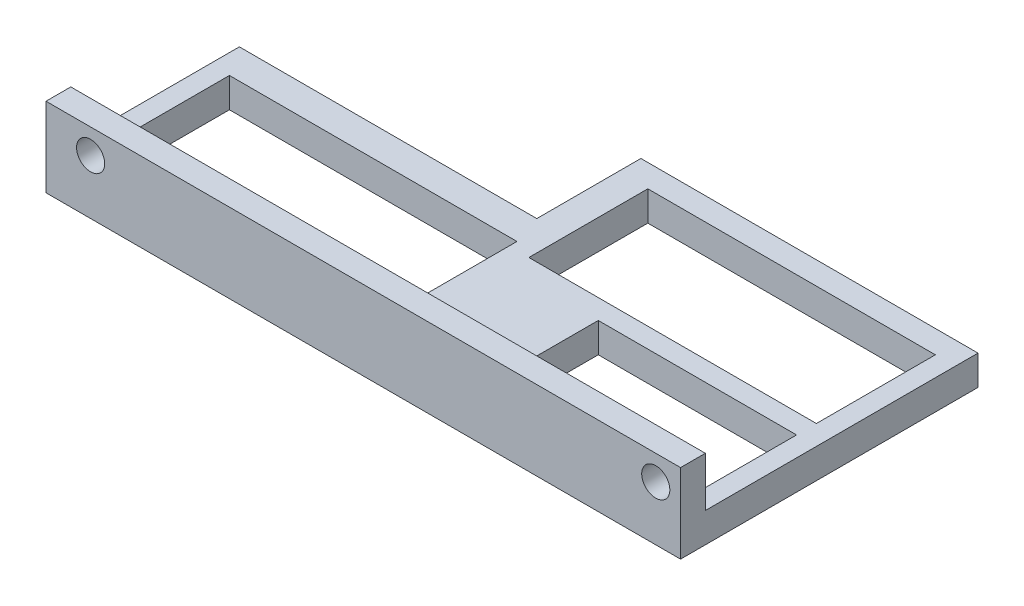
from build123d import *

# Parameters (mm, degrees)
SKETCH1_W           = 64
SKETCH1_H           = 30
BOSS_EXTRUDE1_DEPTH = 3
CUT_EXTRUDE1_REACH  = 72.746
SKETCH2_W           = 29
SKETCH2_H           = 12.5
SKETCH2_H_2         = 12
SKETCH2_W_2         = 20
SKETCH2_H_3         = 9.7
SKETCH2_W_3         = 30
SKETCH2_H_4         = 10.5
SKETCH3_W           = 64
SKETCH3_H           = 2.5
BOSS_EXTRUDE3_DEPTH = 5
CUT_EXTRUDE2_REACH  = 73.134
SKETCH4_R           = 1.419176597


with BuildPart() as part:
    # Sketch1 → Boss-Extrude1 (new body)
    with BuildSketch(Plane(origin=(0, 0, 0), x_dir=(1, 0, 0), z_dir=(0, 1, 0))):
        with Locations((32, 15)):
            Rectangle(SKETCH1_W, SKETCH1_H)
    extrude(amount=BOSS_EXTRUDE1_DEPTH)

    # Sketch2 → Cut-Extrude1 (cut, up to next)
    with BuildSketch(Plane(origin=(0, 3, 0), x_dir=(1, 0, 0), z_dir=(0, 1, 0)), mode=Mode.PRIVATE) as cut_extrude1_sk1:
        with Locations((16.5, 10.25)):
            Rectangle(SKETCH2_W, SKETCH2_H)
    cut_extrude1_tool1 = extrude(cut_extrude1_sk1.sketch, amount=-CUT_EXTRUDE1_REACH, mode=Mode.PRIVATE) & part.part
    # Sketch2 → Cut-Extrude1 (cut, up to next)
    with BuildSketch(Plane(origin=(0, 3, 0), x_dir=(1, 0, 0), z_dir=(0, 1, 0)), mode=Mode.PRIVATE) as cut_extrude1_sk2:
        with Locations((47.5, 21.7)):
            Rectangle(SKETCH2_W, SKETCH2_H_2)
    cut_extrude1_tool2 = extrude(cut_extrude1_sk2.sketch, amount=-CUT_EXTRUDE1_REACH, mode=Mode.PRIVATE) & part.part
    # Sketch2 → Cut-Extrude1 (cut, up to next)
    with BuildSketch(Plane(origin=(0, 3, 0), x_dir=(1, 0, 0), z_dir=(0, 1, 0)), mode=Mode.PRIVATE) as cut_extrude1_sk3:
        with Locations((52, 8.85)):
            Rectangle(SKETCH2_W_2, SKETCH2_H_3)
    cut_extrude1_tool3 = extrude(cut_extrude1_sk3.sketch, amount=-CUT_EXTRUDE1_REACH, mode=Mode.PRIVATE) & part.part
    # Sketch2 → Cut-Extrude1 (cut, up to next)
    with BuildSketch(Plane(origin=(0, 3, 0), x_dir=(1, 0, 0), z_dir=(0, 1, 0)), mode=Mode.PRIVATE) as cut_extrude1_sk4:
        with Locations((15, 24.75)):
            Rectangle(SKETCH2_W_3, SKETCH2_H_4)
    cut_extrude1_tool4 = extrude(cut_extrude1_sk4.sketch, amount=-CUT_EXTRUDE1_REACH, mode=Mode.PRIVATE) & part.part
    add(cut_extrude1_tool1.solids().sort_by_distance((16.5, 3, -10.25))[0], mode=Mode.SUBTRACT)
    add(cut_extrude1_tool2.solids().sort_by_distance((47.5, 3, -21.7))[0], mode=Mode.SUBTRACT)
    add(cut_extrude1_tool3.solids().sort_by_distance((52, 3, -8.85))[0], mode=Mode.SUBTRACT)
    add(cut_extrude1_tool4.solids().sort_by_distance((15, 3, -24.75))[0], mode=Mode.SUBTRACT)

    # Sketch3 → Boss-Extrude3 (add)
    with BuildSketch(Plane(origin=(0, 3, 0), x_dir=(1, 0, 0), z_dir=(0, 1, 0))):
        with Locations((32, 1.25)):
            Rectangle(SKETCH3_W, SKETCH3_H)
    extrude(amount=BOSS_EXTRUDE3_DEPTH)

    # Sketch4 → Cut-Extrude2 (cut, up to next)
    with BuildSketch(Plane.XY, mode=Mode.PRIVATE) as cut_extrude2_sk1:
        with Locations((61.5, 5.5)):
            Circle(SKETCH4_R)
    cut_extrude2_tool1 = extrude(cut_extrude2_sk1.sketch, amount=-CUT_EXTRUDE2_REACH, mode=Mode.PRIVATE) & part.part
    # Sketch4 → Cut-Extrude2 (cut, up to next)
    with BuildSketch(Plane.XY, mode=Mode.PRIVATE) as cut_extrude2_sk2:
        with Locations((4.5, 5.5)):
            Circle(SKETCH4_R)
    cut_extrude2_tool2 = extrude(cut_extrude2_sk2.sketch, amount=-CUT_EXTRUDE2_REACH, mode=Mode.PRIVATE) & part.part
    add(cut_extrude2_tool1.solids().sort_by_distance((61.5, 5.5, 0))[0], mode=Mode.SUBTRACT)
    add(cut_extrude2_tool2.solids().sort_by_distance((4.5, 5.5, 0))[0], mode=Mode.SUBTRACT)


solid = part.part
